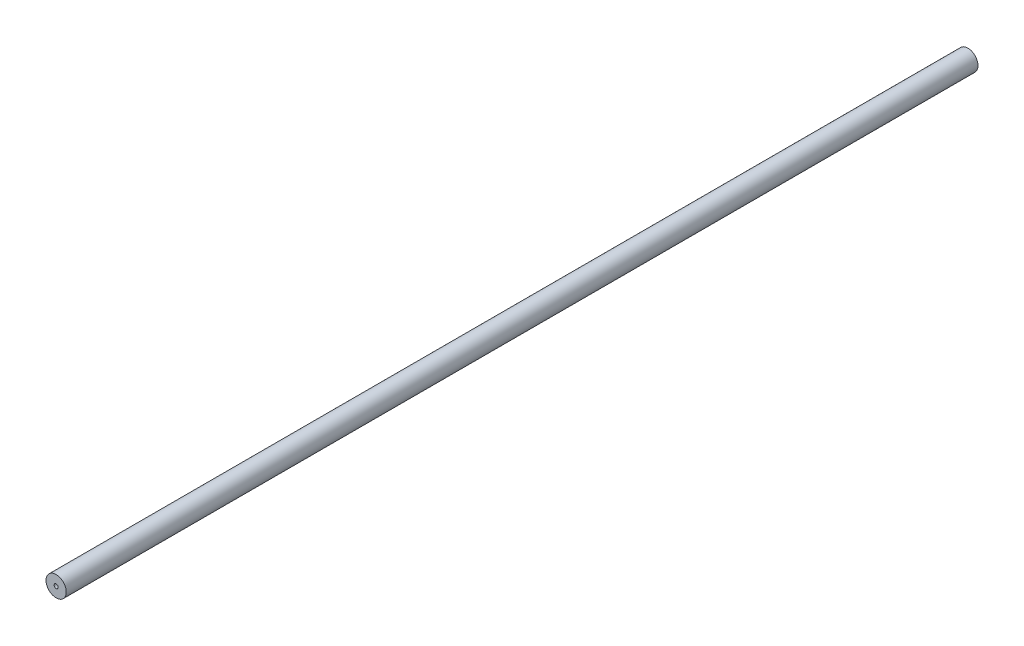
from build123d import *

# Parameters (mm, degrees)
CROQUIS1_R              = 2
CROQUIS1_R_2            = 0.4
SALIENTE_EXTRUIR1_DEPTH = 180


with BuildPart() as part:
    # Croquis1 → Saliente-Extruir1 (new body)
    with BuildSketch(Plane.XY):
        with Locations(Location((0, 0, 0), (0, 0, 180))):
            Circle(CROQUIS1_R)
        Circle(CROQUIS1_R_2, mode=Mode.SUBTRACT)
    extrude(amount=SALIENTE_EXTRUIR1_DEPTH)


solid = part.part
